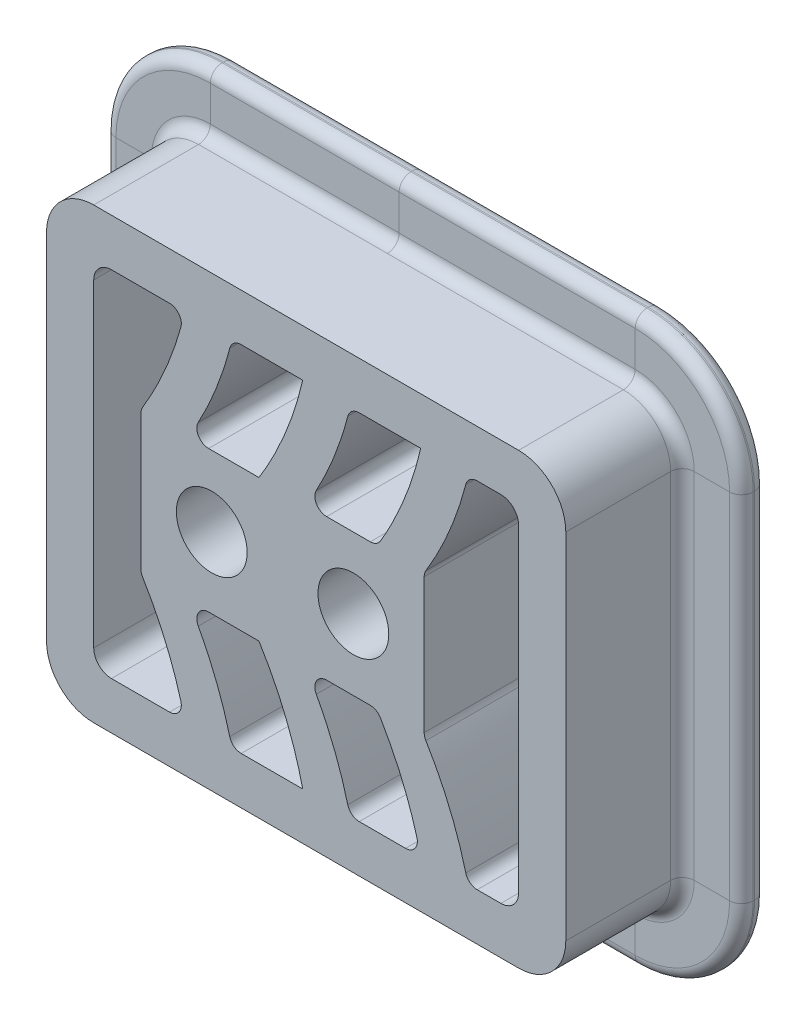
from build123d import *

# Parameters (mm, degrees)
SKETCH1_W           = 12
SKETCH1_H           = 6
SKETCH1_R           = 1.5
BOSS_EXTRUDE1_DEPTH = 3
SKETCH2_W           = 22
SKETCH2_H           = 19
SKETCH2_W_2         = 18
SKETCH2_H_2         = 15
BOSS_EXTRUDE2_DEPTH = 3
BOSS_EXTRUDE3_DEPTH = 3
FILLET3_R           = 2
SKETCH5_W           = 1.059809024
SKETCH5_H           = 2.5
FILLET4_R           = 0.5
FILLET5_R           = 0.75
FILLET6_R           = 0.5


with BuildPart() as part:
    # Sketch1 → Boss-Extrude1 (new, symmetric)
    with BuildSketch(Plane.XY):
        Rectangle(SKETCH1_W, SKETCH1_H)
        with Locations((-3, 0)):
            Circle(SKETCH1_R, mode=Mode.SUBTRACT)
        with Locations((3, 0)):
            Circle(SKETCH1_R, mode=Mode.SUBTRACT)
    extrude(amount=BOSS_EXTRUDE1_DEPTH, both=True)



with BuildPart() as body_2:
    # Sketch2 → Boss-Extrude2 (new, symmetric)
    with BuildSketch(Plane.XY):
        with Locations((1, 0)):
            Rectangle(SKETCH2_W, SKETCH2_H)
        with Locations((1, 0)):
            Rectangle(SKETCH2_W_2, SKETCH2_H_2, mode=Mode.SUBTRACT)
    extrude(amount=BOSS_EXTRUDE2_DEPTH, both=True)


with BuildPart() as part_1:
    add(part.part)

    add(body_2.part)  # Boss-Extrude3 merges body 2
    # Sketch3 → Boss-Extrude3 (add, symmetric)
    with BuildSketch(Plane.XY):
        with BuildLine():
            Line((-6, 3), (-4, 3))
            add(Edge.make_bspline(
                [(-2.144958736, 7.5), (-2.70157804, 5.104997651), (-4, 3)],
                knots=[0, 0, 0, 1, 1, 1], degree=2))
            Line((-2.144958736, 7.5), (-4.144958736, 7.5))
            add(Edge.make_bspline(
                [(-4.144958736, 7.5), (-4.70157804, 5.104997651), (-6, 3)],
                knots=[0, 0, 0, 1, 1, 1], degree=2))
        make_face()
        with BuildLine():
            Line((0.855041264, 7.5), (2.855041264, 7.5))
            add(Edge.make_bspline(
                [(2.855041264, 7.5), (2.29842196, 5.104997651), (1, 3)],
                knots=[0, 0, 0, 1, 1, 1], degree=2))
            Line((1, 3), (-1, 3))
            add(Edge.make_bspline(
                [(0.855041264, 7.5), (0.29842196, 5.104997651), (-1, 3)],
                knots=[0, 0, 0, 1, 1, 1], degree=2))
        make_face()
        with BuildLine():
            Line((5.855041264, 7.5), (7.855041264, 7.5))
            add(Edge.make_bspline(
                [(7.855041264, 7.5), (7.29842196, 5.104997651), (6, 3)],
                knots=[0, 0, 0, 1, 1, 1], degree=2))
            Line((6, 3), (4, 3))
            add(Edge.make_bspline(
                [(5.855041264, 7.5), (5.29842196, 5.104997651), (4, 3)],
                knots=[0, 0, 0, 1, 1, 1], degree=2))
        make_face()
        with BuildLine():
            Line((4, -3), (6, -3))
            add(Edge.make_bspline(
                [(7.855041264, -7.5), (7.29842196, -5.104997651), (6, -3)],
                knots=[0, 0, 0, 1, 1, 1], degree=2))
            Line((7.855041264, -7.5), (5.855041264, -7.5))
            add(Edge.make_bspline(
                [(5.855041264, -7.5), (5.29842196, -5.104997651), (4, -3)],
                knots=[0, 0, 0, 1, 1, 1], degree=2))
        make_face()
        with BuildLine():
            Line((-1, -3), (1, -3))
            add(Edge.make_bspline(
                [(2.855041264, -7.5), (2.29842196, -5.104997651), (1, -3)],
                knots=[0, 0, 0, 1, 1, 1], degree=2))
            Line((2.855041264, -7.5), (0.855041264, -7.5))
            add(Edge.make_bspline(
                [(0.855041264, -7.5), (0.29842196, -5.104997651), (-1, -3)],
                knots=[0, 0, 0, 1, 1, 1], degree=2))
        make_face()
        with BuildLine():
            Line((-6, -3), (-4, -3))
            add(Edge.make_bspline(
                [(-2.144958736, -7.5), (-2.70157804, -5.104997651), (-4, -3)],
                knots=[0, 0, 0, 1, 1, 1], degree=2))
            Line((-2.144958736, -7.5), (-4.144958736, -7.5))
            add(Edge.make_bspline(
                [(-4.144958736, -7.5), (-4.70157804, -5.104997651), (-6, -3)],
                knots=[0, 0, 0, 1, 1, 1], degree=2))
        make_face()
    extrude(amount=BOSS_EXTRUDE3_DEPTH, both=True)

    # Fillet3
    fillet3_edges = [part_1.edges().sort_by_distance(p)[0] for p in [
        (-10, -9.5, 0),
        (12, -9.5, 0),
        (12, 9.5, 0),
        (-10, 9.5, 0),
    ]]
    fillet(fillet3_edges, radius=FILLET3_R)

    # Sweep1: sweep along a path in Sketch6
    with BuildLine(Plane.XY) as sweep1_path:
        Line((12, -7.5), (12, 7.5))
        ThreePointArc((12, 7.5), (11.414213562, 8.914213562), (10, 9.5))
        Line((10, 9.5), (-8, 9.5))
        ThreePointArc((-8, 9.5), (-9.414213562, 8.914213562), (-10, 7.5))
        Line((-10, 7.5), (-10, -7.5))
        ThreePointArc((-10, -7.5), (-9.414213562, -8.914213562), (-8, -9.5))
        Line((-8, -9.5), (10, -9.5))
        ThreePointArc((10, -9.5), (11.414213562, -8.914213562), (12, -7.5))
    # Sketch5 → Sweep1 (sweep)
    with BuildSketch(Plane(origin=(0, 0, 0), x_dir=(0, 0, -1), z_dir=(1, 0, 0))):
        with Locations((2.470095488, 10.75)):
            Rectangle(SKETCH5_W, SKETCH5_H)
    sweep(path=sweep1_path.line)

    # Fillet4
    fillet4_edges = [part_1.edges().sort_by_distance(p)[0] for p in [
        (1, 12, -3),
        (1, 9.5, -1.940190976),
        (-11.181980515, 10.681980515, -3),
        (-9.414213562, 8.914213562, -1.940190976),
        (-11.181980515, 10.681980515, -1.940190976),
        (-12.5, 0, -3),
        (-10, 0, -1.940190976),
        (-12.5, 0, -1.940190976),
        (-11.181980515, -10.681980515, -3),
        (-9.414213562, -8.914213562, -1.940190976),
        (-11.181980515, -10.681980515, -1.940190976),
        (1, -12, -3),
        (1, -9.5, -1.940190976),
        (1, -12, -1.940190976),
        (13.181980515, -10.681980515, -3),
        (11.414213562, -8.914213562, -1.940190976),
        (13.181980515, -10.681980515, -1.940190976),
        (14.5, 0, -3),
        (12, 0, -1.940190976),
        (14.5, 0, -1.940190976),
        (13.181980515, 10.681980515, -3),
        (11.414213562, 8.914213562, -1.940190976),
        (13.181980515, 10.681980515, -1.940190976),
        (1, 12, -3),
        (1, 9.5, -1.940190976),
        (1, 12, -1.940190976),
        (1, 12, -1.940190976),
    ]]
    fillet(fillet4_edges, radius=FILLET4_R)

    # Fillet5
    fillet5_edges = [part_1.edges().sort_by_distance(p)[0] for p in [
        (-8, 7.5, 0),
        (10, 7.5, 0),
        (-8, -7.5, 0),
        (10, -7.5, 0),
    ]]
    fillet(fillet5_edges, radius=FILLET5_R)

    # Fillet6
    fillet6_edges = [part_1.edges().sort_by_distance(p)[0] for p in [
        (-4.144958736, -7.5, 1.5),
        (-4.144958736, 7.5, 1.5),
        (-6, -3, 1.5),
        (-6, 3, -1.5),
        (4, 3, 1.5),
        (1, 3, 1.5),
        (-4, 3, 1.5),
        (-2.144958736, 7.5, 1.5),
        (2.855041264, 7.5, 1.5),
        (7.855041264, 7.5, 1.5),
        (6, 3, -1.5),
        (6, -3, 1.5),
        (7.855041264, -7.5, 1.5),
        (4, -3, 1.5),
        (5.855041264, -7.5, 1.5),
        (2.855041264, -7.5, 1.5),
        (1, -3, -1.5),
        (-4, -3, 1.5),
        (-2.144958736, -7.5, 1.5),
    ]]
    fillet(fillet6_edges, radius=FILLET6_R)


solid = part_1.part
